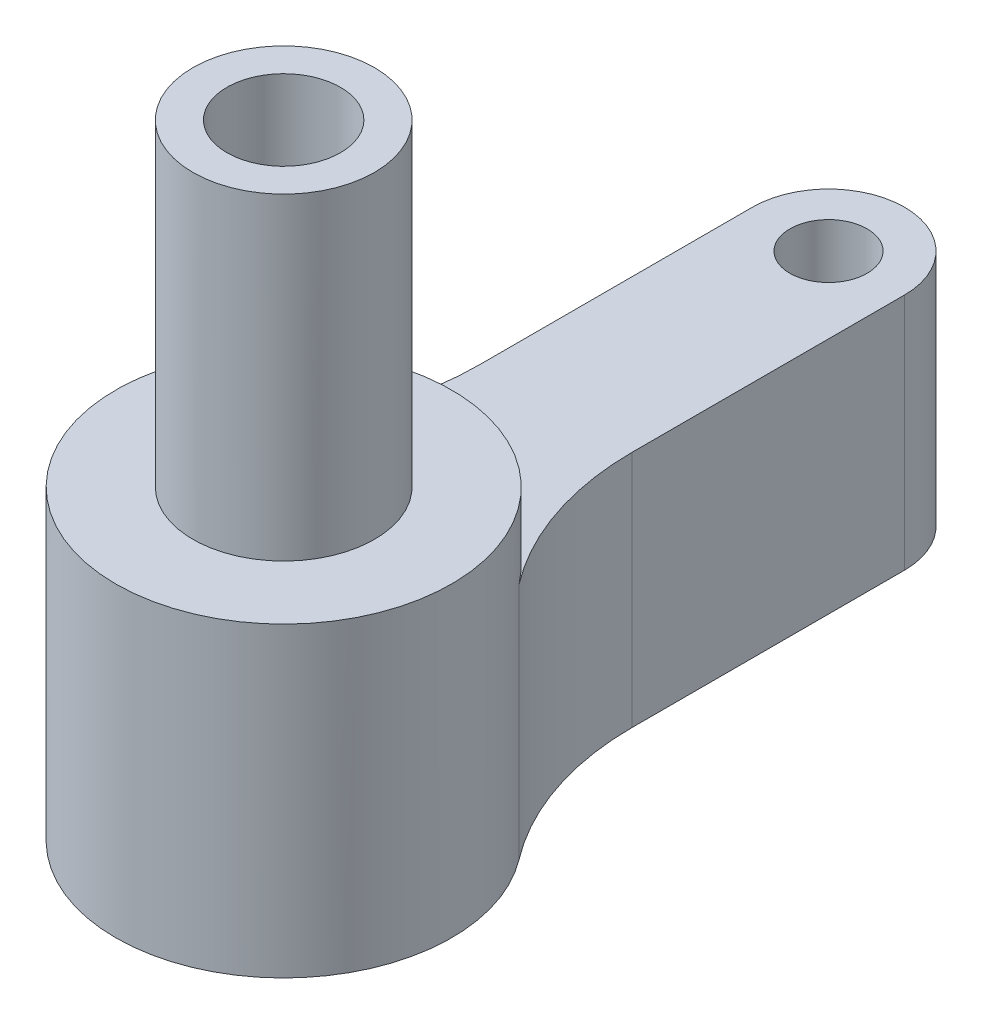
from build123d import *
from build123d.topology import SkipClean

# Parameters (mm, degrees)
BOSS_EXTRUDE1_DEPTH      = 6.75
BOSS_EXTRUDE1_DEPTH_BACK = 6.75
SKETCH1_R                = 1.7
SKETCH2_R                = 4
BOSS_EXTRUDE2_DEPTH      = 14
SKETCH3_R                = 2.5
CUT_EXTRUDE1_DEPTH       = 5
SKETCH4_R                = 1.7
CUT_EXTRUDE2_DEPTH       = 17.5
CUT_EXTRUDE4_START       = -3
CUT_EXTRUDE4_DEPTH       = 3


with BuildPart() as part:
    # Sketch1 → Boss-Extrude1 (new, two sides: drawn at the far end of the back side and taken through both)
    with BuildSketch(Plane(origin=(0, 0, 0), x_dir=(1, 0, 0), z_dir=(0, 1, 0)).offset(-BOSS_EXTRUDE1_DEPTH_BACK)):
        with BuildLine():
            Line((-3.35, 24), (-3.35, 12))
            ThreePointArc((-3.35, 12), (-4.001241595, 8.033856538), (-5.886575957, 4.484219386))
            ThreePointArc((-5.886575957, 4.484219386), (0, -7.4), (5.886575957, 4.484219386))
            ThreePointArc((5.886575957, 4.484219386), (4.001241595, 8.033856538), (3.35, 12))
            Line((3.35, 12), (3.35, 24))
            ThreePointArc((3.35, 24), (0, 27.35), (-3.35, 24))
        make_face()
        with Locations(Location((0, 24, 0), (0, 0, 270))):
            Circle(SKETCH1_R, mode=Mode.SUBTRACT)
    extrude(amount=BOSS_EXTRUDE1_DEPTH + BOSS_EXTRUDE1_DEPTH_BACK)

    # Sketch2 → Boss-Extrude2 (add)
    with BuildSketch(Plane(origin=(0, 6.75, 0), x_dir=(1, 0, 0), z_dir=(0, 1, 0))):
        with Locations(Location((0, 0, 0), (0, 0, 90))):
            Circle(SKETCH2_R)
    extrude(amount=BOSS_EXTRUDE2_DEPTH)

    # Sketch3 → Cut-Extrude1 (cut)
    with BuildSketch(Plane(origin=(0, 20.75, 0), x_dir=(1, 0, 0), z_dir=(0, 1, 0))):
        with Locations(Location((0, 0, 0), (0, 0, 270))):
            Circle(SKETCH3_R)
    extrude(amount=-CUT_EXTRUDE1_DEPTH, mode=Mode.SUBTRACT)

    # Sketch4 → Cut-Extrude2 (cut)
    with BuildSketch(Plane(origin=(0, 15.75, 0), x_dir=(1, 0, 0), z_dir=(0, 1, 0))):
        with Locations(Location((0, 0, 0), (0, 0, 270))):
            Circle(SKETCH4_R)
    extrude(amount=-CUT_EXTRUDE2_DEPTH, mode=Mode.SUBTRACT)

    # Sketch5 → Cut-Extrude4 (cut)
    with SkipClean():  # the faces are left unmerged after this step: merging them gives an invalid solid
        with BuildSketch(Plane(origin=(0, 6.75, 0), x_dir=(1, 0, 0), z_dir=(0, 1, 0)).offset(CUT_EXTRUDE4_START)):
            with BuildLine():
                Line((3.35, 12), (3.35, 24))
                ThreePointArc((3.35, 24), (0, 27.35), (-3.35, 24))
                Line((-3.35, 24), (-3.35, 12))
                ThreePointArc((-3.35, 12), (-4.001241595, 8.033856538), (-5.886575957, 4.484219386))
                ThreePointArc((-5.886575957, 4.484219386), (0, 7.4), (5.886575957, 4.484219386))
                ThreePointArc((5.886575957, 4.484219386), (4.001241595, 8.033856538), (3.35, 12))
            make_face()
        extrude(amount=CUT_EXTRUDE4_DEPTH, mode=Mode.SUBTRACT)


solid = part.part
